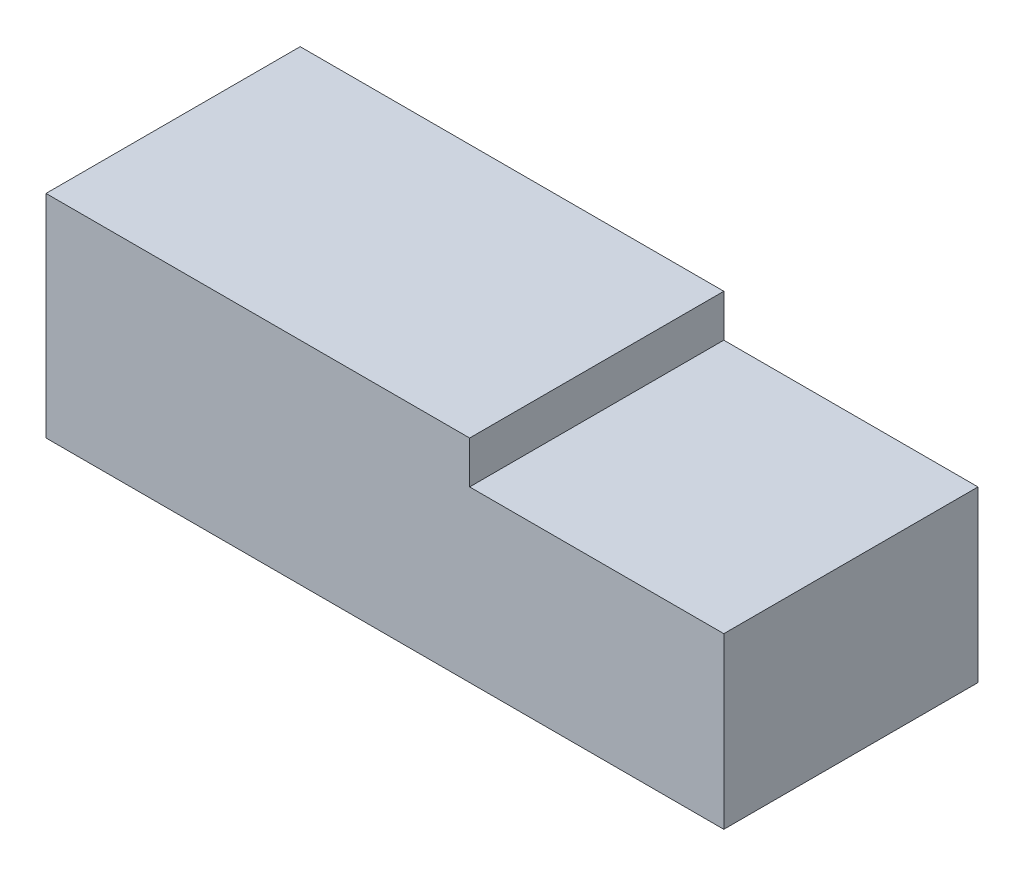
from build123d import *

# Parameters (mm, degrees)
BOSS_EXTRUDE1_DEPTH = 38.1


with BuildPart() as part:
    # Sketch1 → Boss-Extrude1 (new body)
    with BuildSketch(Plane.XY):
        Polygon((0, 0), (101.6, 0), (101.6, 25.4), (63.5, 25.4), (63.5, 31.75), (0, 31.75), align=None)
    extrude(amount=BOSS_EXTRUDE1_DEPTH)


solid = part.part
